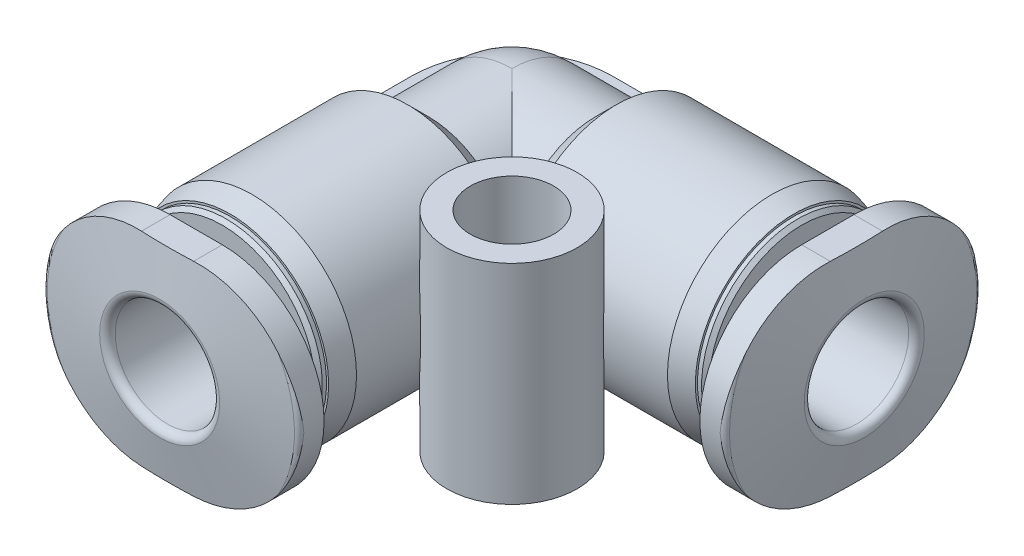
from build123d import *

# Parameters (mm, degrees)
SCHNITT_LINEAR_AUSTRAGEN1_DEPTH      = 1.4
AUFSATZ_LINEAR_START                 = 4
AUFSATZ_LINEAR_AUSTRAGEN1_DEPTH      = 4
AUFSATZ_LINEAR_AUSTRAGEN2_DEPTH      = 4
SCHNITT_LINEAR_AUSTRAGEN2_DEPTH      = 1.4
AUFSATZ_LINEAR_AUSTRAGEN3_DEPTH      = 4
AUFSATZ_LINEAR_AUSTRAGEN3_DEPTH_BACK = 4
SKIZZE9_R                            = 2.5
BOHRUNG1_D                           = 3.2
BOHRUNG1_DEPTH                       = 9
ROTATION3_ANGLE                      = 90


with BuildPart() as part:
    # Skizze1 → Rotation1 (revolve)
    with BuildSketch(Plane.XY):
        with BuildLine():
            Line((0, 3.2), (3.2, 3.2))
            Line((3.2, 3.2), (4, 4))
            Line((4, 4), (9.957142857, 4))
            Line((9.957142857, 4), (10.8, 3.774157109))
            Line((10.8, 3.774157109), (10.8, 3.693772352))
            Line((10.8, 3.693772352), (10.958578644, 3.693772352))
            Line((10.958578644, 3.693772352), (11.1, 3.552350995))
            Line((11.1, 3.552350995), (11.1, 2.7))
            Line((11.1, 2.7), (11.73, 2.7))
            ThreePointArc((11.73, 2.7), (11.991629509, 2.808370491), (12.1, 3.07))
            Line((12.1, 3.07), (12.1, 4.9))
            Line((12.1, 4.9), (12.873729924, 4.9))
            ThreePointArc((12.873729924, 4.9), (13.002287446, 4.853208889), (13.070691475, 4.734729636))
            Line((13.070691475, 4.734729636), (13.5, 2.3))
            Line((13.5, 2.3), (13.5, 0))
            Line((13.5, 0), (-3.2, 0))
            ThreePointArc((-3.2, 0), (-2.2627417, 2.2627417), (0, 3.2))
        make_face()
    revolve(axis=Axis((13.5, 0, 0), (-1, 0, 0)))

    # Skizze2 → Schnitt-Linear austragen1 (cut)
    with BuildSketch(Plane(origin=(13.5, 0, 0), x_dir=(0, 0, -1), z_dir=(1, 0, 0))):
        Polygon((-5.88, -3.394819583), (0, -6.789639166), (5.88, -3.394819583), (5.88, 3.394819583), (0, 6.789639166), (-5.88, 3.394819583), align=None)
        with BuildLine():
            Line((-1, -3.9), (1, -3.9))
            ThreePointArc((1, -3.9), (3.757716447, -2.757716447), (4.9, 0))
            ThreePointArc((4.9, 0), (3.757716447, 2.757716447), (1, 3.9))
            Line((1, 3.9), (-1, 3.9))
            ThreePointArc((-1, 3.9), (-3.757716447, 2.757716447), (-4.9, 0))
            ThreePointArc((-4.9, 0), (-3.757716447, -2.757716447), (-1, -3.9))
        make_face(mode=Mode.SUBTRACT)
    extrude(amount=-SCHNITT_LINEAR_AUSTRAGEN1_DEPTH, mode=Mode.SUBTRACT)

    # Skizze3 → Aufsatz-Linear austragen1 (add)
    with BuildSketch(Plane(origin=(0, 0, 0), x_dir=(0, 0, -1), z_dir=(1, 0, 0)).offset(AUFSATZ_LINEAR_START)):
        with BuildLine():
            Line((-3.872983346, -1), (3.872983346, -1))
            ThreePointArc((3.872983346, -1), (4, 0), (3.872983346, 1))
            Line((3.872983346, 1), (-3.872983346, 1))
            ThreePointArc((-3.872983346, 1), (-4, 0), (-3.872983346, -1))
        make_face()
    extrude(amount=-AUFSATZ_LINEAR_AUSTRAGEN1_DEPTH)

    # Skizze5 → Aufsatz-Linear austragen2 (add)
    with BuildSketch(Plane.XY):
        with BuildLine():
            Line((-3.872983346, -1), (0, -1))
            Line((0, -1), (0, 1))
            Line((0, 1), (-3.872983346, 1))
            ThreePointArc((-3.872983346, 1), (-4, 0), (-3.872983346, -1))
        make_face()
    extrude(amount=AUFSATZ_LINEAR_AUSTRAGEN2_DEPTH)

    # Skizze6 → Rotation2 (revolve)
    with BuildSketch(Plane(origin=(0, 0, 0), x_dir=(0, 0, -1), z_dir=(1, 0, 0))):
        with BuildLine():
            Line((0, 0), (0, -3.2))
            Line((0, -3.2), (-3.2, -3.2))
            Line((-3.2, -3.2), (-4, -4))
            Line((-4, -4), (-9.957142857, -4))
            Line((-9.957142857, -4), (-10.8, -3.774157109))
            Line((-10.8, -3.774157109), (-10.8, -3.693772352))
            Line((-10.8, -3.693772352), (-10.958578644, -3.693772352))
            Line((-10.958578644, -3.693772352), (-11.1, -3.552350995))
            Line((-11.1, -3.552350995), (-11.1, -2.7))
            Line((-11.1, -2.7), (-11.73, -2.7))
            ThreePointArc((-11.73, -2.7), (-11.991629509, -2.808370491), (-12.1, -3.07))
            Line((-12.1, -3.07), (-12.1, -4.9))
            Line((-12.1, -4.9), (-12.873729924, -4.9))
            ThreePointArc((-12.873729924, -4.9), (-13.002287446, -4.853208889), (-13.070691475, -4.734729636))
            Line((-13.070691475, -4.734729636), (-13.5, -2.3))
            Line((-13.5, -2.3), (-13.5, 0))
            Line((-13.5, 0), (0, 0))
        make_face()
    revolve(axis=Axis((0, 0, 13.5), (0, 0, -1)))

    # Skizze7 → Schnitt-Linear austragen2 (cut)
    with BuildSketch(Plane.XY.offset(13.5)):
        Polygon((-5.88, -3.394819583), (0, -6.789639166), (5.88, -3.394819583), (5.88, 3.394819583), (0, 6.789639166), (-5.88, 3.394819583), align=None)
        with BuildLine():
            Line((-1, -3.9), (1, -3.9))
            ThreePointArc((1, -3.9), (3.757716447, -2.757716447), (4.9, 0))
            ThreePointArc((4.9, 0), (3.757716447, 2.757716447), (1, 3.9))
            Line((1, 3.9), (-1, 3.9))
            ThreePointArc((-1, 3.9), (-3.757716447, 2.757716447), (-4.9, 0))
            ThreePointArc((-4.9, 0), (-3.757716447, -2.757716447), (-1, -3.9))
        make_face(mode=Mode.SUBTRACT)
    extrude(amount=-SCHNITT_LINEAR_AUSTRAGEN2_DEPTH, mode=Mode.SUBTRACT)

    # Skizze9 → Aufsatz-Linear austragen3 (add, two sides: drawn at the far end of the back side and taken through both)
    with BuildSketch(Plane(origin=(0, 0, 0), x_dir=(1, 0, 0), z_dir=(0, 1, 0)).offset(-AUFSATZ_LINEAR_AUSTRAGEN3_DEPTH_BACK)):
        with Locations((5.5, -5.5)):
            Circle(SKIZZE9_R)
    extrude(amount=AUFSATZ_LINEAR_AUSTRAGEN3_DEPTH + AUFSATZ_LINEAR_AUSTRAGEN3_DEPTH_BACK)

    # Bohrung1
    with Locations(Plane(origin=(0, 4, 0), x_dir=(1, 0, 0), z_dir=(0, 1, 0))):
        with Locations((5.5, -5.5)):
            Hole(BOHRUNG1_D / 2, depth=BOHRUNG1_DEPTH)

    # Skizze12 → Rotation3 (revolve)
    with BuildSketch(Plane(origin=(0, 0, 0), x_dir=(0, 0, -1), z_dir=(1, 0, 0))):
        with BuildLine():
            Line((0, 1), (3.872983346, 1))
            ThreePointArc((3.872983346, 1), (4, 0), (3.872983346, -1))
            Line((3.872983346, -1), (0, -1))
            Line((0, -1), (0, 1))
        make_face()
    revolve(axis=Axis((0, -1, 0), (0, 1, 0)), revolution_arc=ROTATION3_ANGLE)

    # Skizze8 → Schnitt-Rotation1 (revolve, cut)
    with BuildSketch(Plane(origin=(0, 0, 0), x_dir=(0, 0, -1), z_dir=(1, 0, 0))):
        with BuildLine():
            Line((0, 0), (0, -1.5))
            Line((0, -1.5), (-2, -1.5))
            Line((-2, -1.5), (-2, -1.8))
            ThreePointArc((-2, -1.8), (-2.058578644, -1.941421356), (-2.2, -2))
            Line((-2.2, -2), (-13.2, -2))
            ThreePointArc((-13.2, -2), (-13.412132034, -2.087867966), (-13.5, -2.3))
            Line((-13.5, -2.3), (-13.5, 0))
            Line((-13.5, 0), (0, 0))
        make_face()
    revolve(axis=Axis((0, 0, 13.5), (0, 0, -1)), mode=Mode.SUBTRACT)

    # Skizze4 → Schnitt-Rotation2 (revolve, cut)
    with BuildSketch(Plane(origin=(0, 0, 0), x_dir=(1, 0, 0), z_dir=(0, 1, 0))):
        with BuildLine():
            Line((0, 1.5), (2, 1.5))
            Line((2, 1.5), (2, 1.8))
            ThreePointArc((2, 1.8), (2.058578644, 1.941421356), (2.2, 2))
            Line((2.2, 2), (13.2, 2))
            ThreePointArc((13.2, 2), (13.412132034, 2.087867966), (13.5, 2.3))
            Line((13.5, 2.3), (13.5, 0))
            Line((13.5, 0), (-1.5, 0))
            ThreePointArc((-1.5, 0), (-1.060660172, 1.060660172), (0, 1.5))
        make_face()
    revolve(axis=Axis((13.5, 0, 0), (-1, 0, 0)), mode=Mode.SUBTRACT)


solid = part.part
